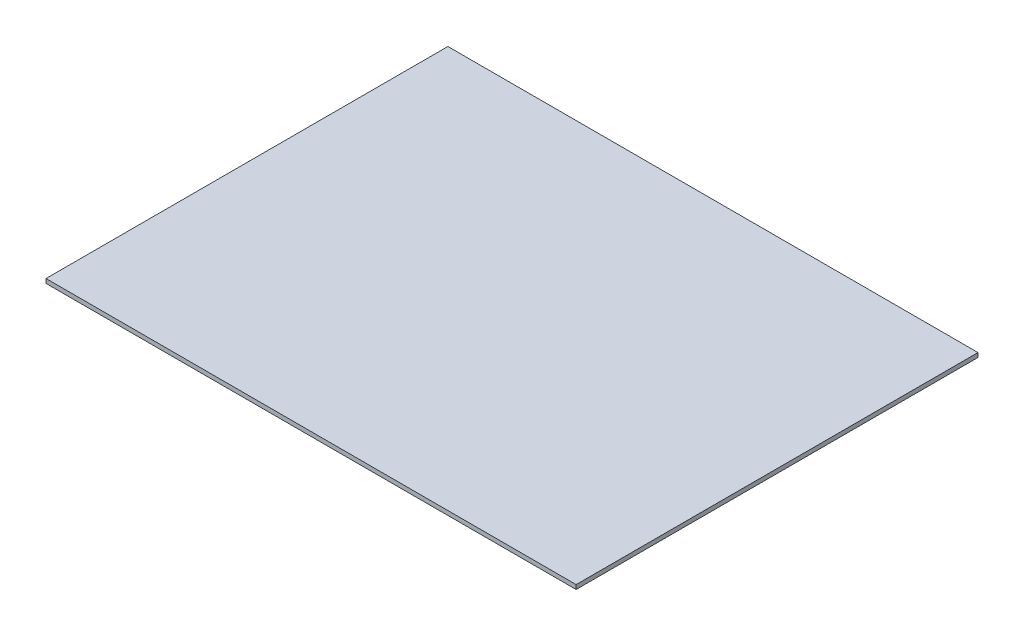
from build123d import *

# Parameters (mm, degrees)
SKETCH1_W           = 1574.8
SKETCH1_H           = 1193.8
BOSS_EXTRUDE1_DEPTH = 12.7


with BuildPart() as part:
    # Sketch1 → Boss-Extrude1 (new body)
    with BuildSketch(Plane(origin=(0, 0, 0), x_dir=(1, 0, 0), z_dir=(0, 1, 0))):
        Rectangle(SKETCH1_W, SKETCH1_H)
    extrude(amount=BOSS_EXTRUDE1_DEPTH)


solid = part.part
